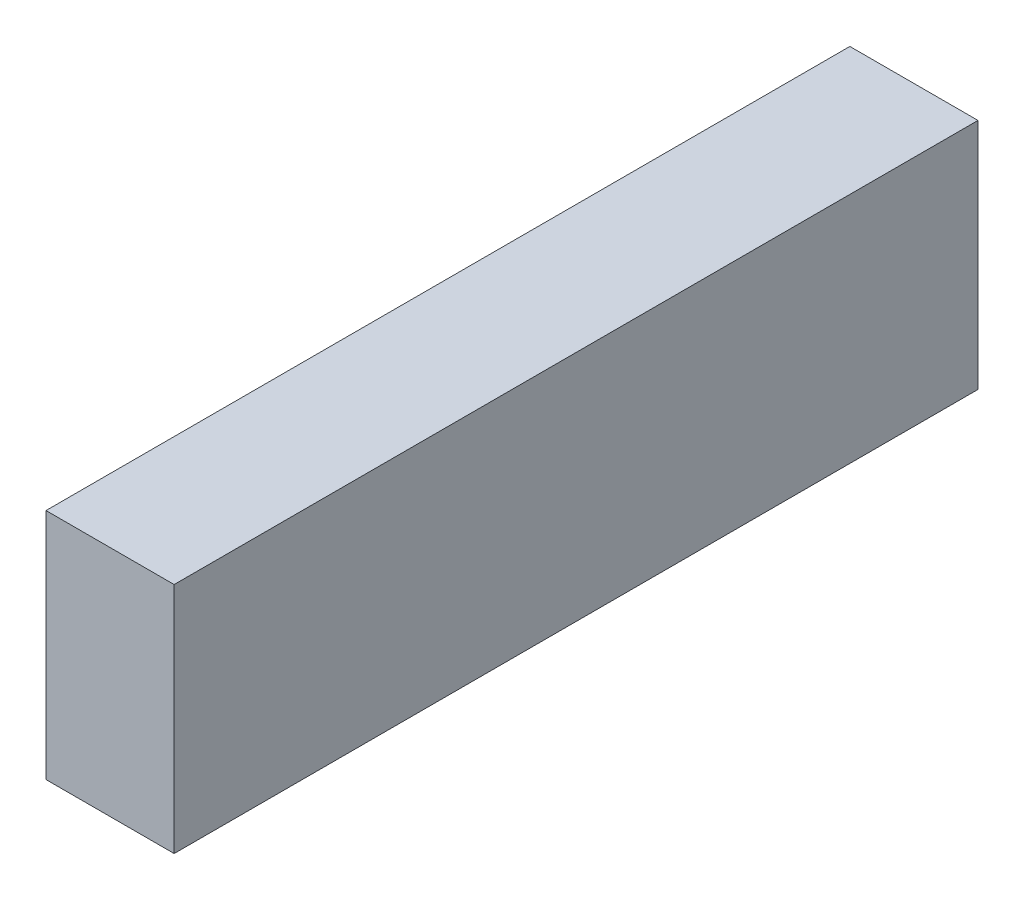
from build123d import *

# Parameters (mm, degrees)
SKETCH_1_W      = 22
SKETCH_1_H      = 40
EXTRUDE_1_DEPTH = 138


with BuildPart() as part:
    # 草图1 → 凸台-拉伸1 (new body)
    with BuildSketch(Plane.XY):
        Rectangle(SKETCH_1_W, SKETCH_1_H)
    extrude(amount=EXTRUDE_1_DEPTH)


solid = part.part
